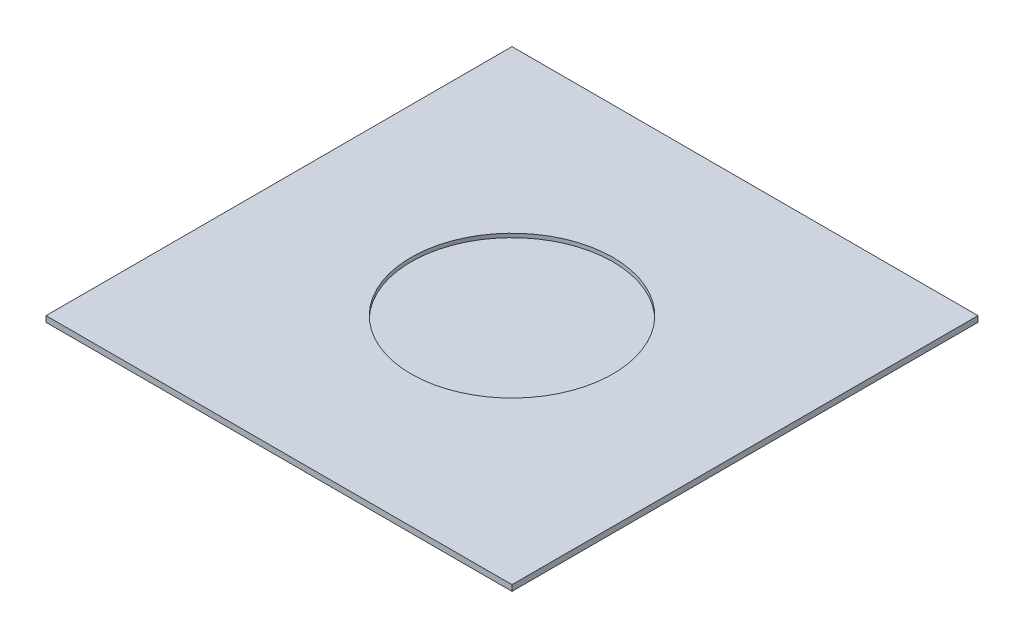
from build123d import *

# Parameters (mm, degrees)
SKETCH_1_W          = 1200
SKETCH_1_H          = 1200
EXTRUDE_1_DEPTH     = 15
SKETCH_2_R          = 260
CUT_EXTRUDE_1_DEPTH = 10


with BuildPart() as part:
    # 스케치1 → 보스-돌출1 (new body)
    with BuildSketch(Plane(origin=(0, 0, 0), x_dir=(1, 0, 0), z_dir=(0, 1, 0))):
        Rectangle(SKETCH_1_W, SKETCH_1_H)
    extrude(amount=EXTRUDE_1_DEPTH)

    # 스케치2 → 컷-돌출1 (cut)
    with BuildSketch(Plane(origin=(0, 15, 0), x_dir=(1, 0, 0), z_dir=(0, 1, 0))):
        with Locations(Location((0, 0, 0), (0, 0, 270))):
            Circle(SKETCH_2_R)
    extrude(amount=-CUT_EXTRUDE_1_DEPTH, mode=Mode.SUBTRACT)


solid = part.part
